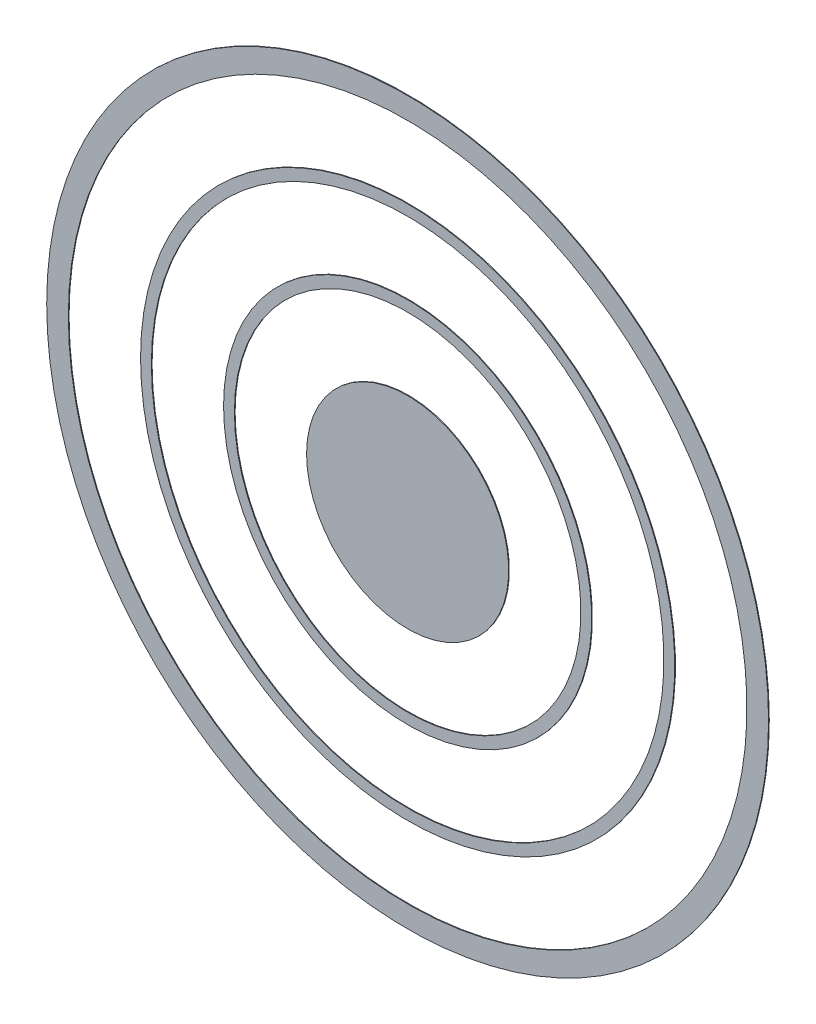
from build123d import *

# Parameters (mm, degrees)
SKETCH_1_R        = 5
SKETCH_1_R_2      = 4.7
EXTRUDE_1_DEPTH   = 0.01
SKETCH_1_R_3      = 3.7
SKETCH_1_R_4      = 3.55
EXTRUDE_1_2_DEPTH = 0.01
SKETCH_1_R_5      = 2.55
SKETCH_1_R_6      = 2.4
EXTRUDE_1_3_DEPTH = 0.01
SKETCH_1_R_7      = 1.4
EXTRUDE_1_4_DEPTH = 0.01


with BuildPart() as part:
    # Эскиз1 → Бобышка-Вытянуть1 (new body)
    with BuildSketch(Plane.XY):
        with Locations(Location((0, 0, 0), (0, 0, 180))):
            Circle(SKETCH_1_R)
        with Locations(Location((0, 0, 0), (0, 0, 180))):
            Circle(SKETCH_1_R_2, mode=Mode.SUBTRACT)
    extrude(amount=EXTRUDE_1_DEPTH)


with BuildPart() as body_2:
    # Эскиз1 → Extrude 1 2 (new body)
    with BuildSketch(Plane.XY):
        with Locations(Location((0, 0, 0), (0, 0, 180))):
            Circle(SKETCH_1_R_3)
        with Locations(Location((0, 0, 0), (0, 0, 180))):
            Circle(SKETCH_1_R_4, mode=Mode.SUBTRACT)
    extrude(amount=EXTRUDE_1_2_DEPTH)


with BuildPart() as body_3:
    # Эскиз1 → Extrude 1 3 (new body)
    with BuildSketch(Plane.XY):
        with Locations(Location((0, 0, 0), (0, 0, 180))):
            Circle(SKETCH_1_R_5)
        with Locations(Location((0, 0, 0), (0, 0, 180))):
            Circle(SKETCH_1_R_6, mode=Mode.SUBTRACT)
    extrude(amount=EXTRUDE_1_3_DEPTH)


with BuildPart() as body_4:
    # Эскиз1 → Extrude 1 4 (new body)
    with BuildSketch(Plane.XY):
        with Locations(Location((0, 0, 0), (0, 0, 180))):
            Circle(SKETCH_1_R_7)
    extrude(amount=EXTRUDE_1_4_DEPTH)


solid = Compound([part.part, body_2.part, body_3.part, body_4.part])
